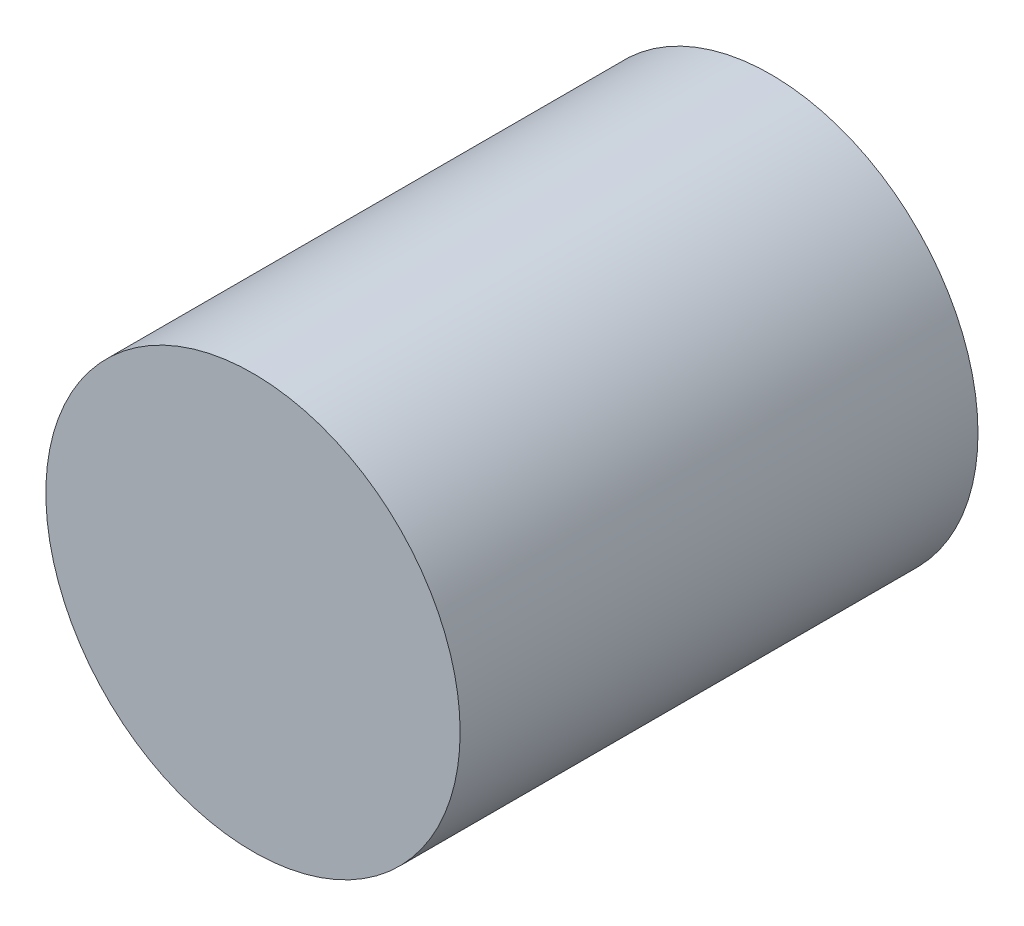
from build123d import *

# Parameters (mm, degrees)
SKETCH2_R           = 20
BOSS_EXTRUDE1_DEPTH = 50


with BuildPart() as part:
    # Sketch2 → Boss-Extrude1 (new body)
    with BuildSketch(Plane.XY):
        Circle(SKETCH2_R)
    extrude(amount=BOSS_EXTRUDE1_DEPTH)


solid = part.part
